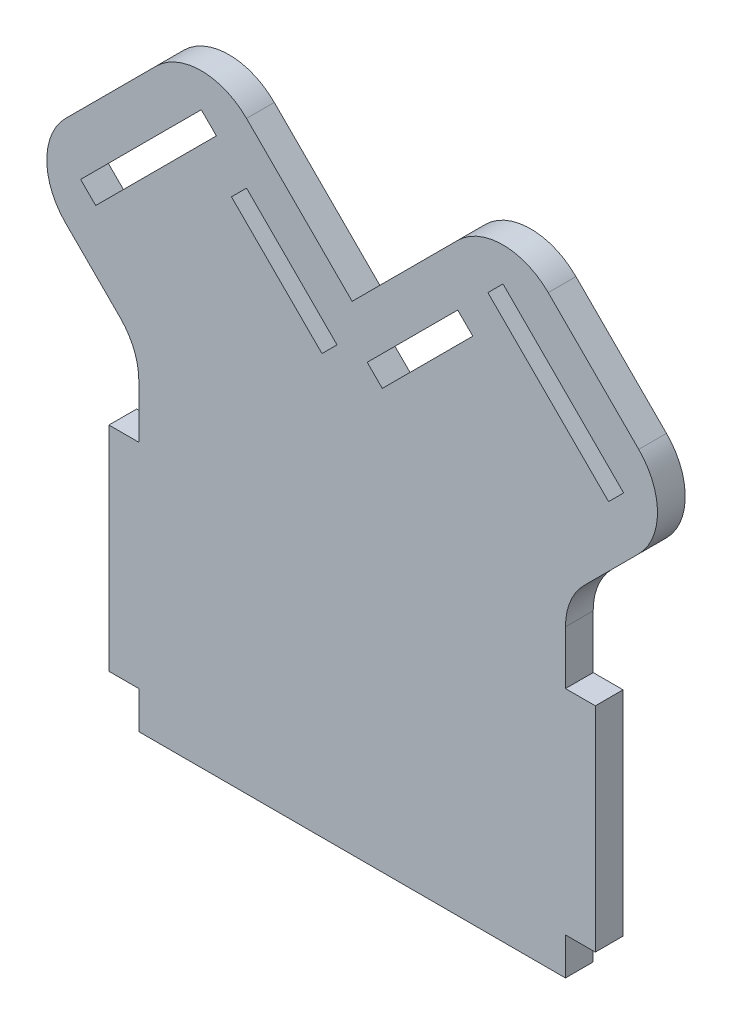
from build123d import *

# Parameters (mm, degrees)
BOSS_EXTRUDE1_DEPTH = 1.3
FILLET1_R           = 3
CUT_EXTRUDE1_DEPTH  = 26.902339963
SKETCH2_3_W         = 1.4
SKETCH2_3_H         = 10
BOSS_EXTRUDE2_DEPTH = 1.3
SKETCH3_W           = 20
SKETCH3_H           = 2
CUT_EXTRUDE2_DEPTH  = 26.902339963
CUT_EXTRUDE3_DEPTH  = 26.902339963


with BuildPart() as part:
    # Sketch1 → Boss-Extrude1 (new body)
    with BuildSketch(Plane.XY):
        Polygon((-15.556349186, 14.306349186), (-10, 8.75), (-10, -8.75), (10, -8.75), (10, 8.75), (15.556349186, 14.306349186), (7.071067812, 22.79163056), (0, 15.720562748), (-7.071067812, 22.79163056), align=None)
    extrude(amount=BOSS_EXTRUDE1_DEPTH)

    # Fillet1
    fillet1_edges = [part.edges().sort_by_distance(p)[0] for p in [
        (-10, 8.75, 0.65),
        (10, 8.75, 0.65),
        (-15.556349186, 14.306349186, 0.65),
        (-7.071067812, 22.79163056, 0.65),
        (7.071067812, 22.79163056, 0.65),
        (15.556349186, 14.306349186, 0.65),
    ]]
    fillet(fillet1_edges, radius=FILLET1_R)

    # Sketch2 → Cut-Extrude1 (cut, through all)
    with BuildSketch(Plane.XY.offset(1.3)):
        Polygon((7.071067812, 19.963203436), (12.727922061, 14.306349186), (12.02081528, 13.599242405), (6.363961031, 19.256096654), align=None)
        Polygon((-12.727922061, 14.306349186), (-12.02081528, 13.599242405), (-6.363961031, 19.256096654), (-7.071067812, 19.963203436), align=None)
    extrude(amount=-CUT_EXTRUDE1_DEPTH, mode=Mode.SUBTRACT)

    # Sketch2<3> → Boss-Extrude2 (add)
    with BuildSketch(Plane.XY.offset(1.3)):
        with Locations((-10.7, 0)):
            Rectangle(SKETCH2_3_W, SKETCH2_3_H)
        with Locations((10.7, 0)):
            Rectangle(SKETCH2_3_W, SKETCH2_3_H)
    extrude(amount=-BOSS_EXTRUDE2_DEPTH)

    # Sketch3 → Cut-Extrude2 (cut, through all)
    with BuildSketch(Plane.XY.offset(1.3)):
        with Locations((0, -7.75)):
            Rectangle(SKETCH3_W, SKETCH3_H)
    extrude(amount=-CUT_EXTRUDE2_DEPTH, mode=Mode.SUBTRACT)

    # Sketch4 → Cut-Extrude3 (cut, through all)
    with BuildSketch(Plane.XY.offset(1.3)):
        Polygon((-4.949747468, 17.841883092), (-0.707106781, 13.599242405), (-1.414213562, 12.892135624), (-5.656854249, 17.134776311), align=None)
        Polygon((1.414213562, 12.892135624), (5.656854249, 17.134776311), (4.949747468, 17.841883092), (0.707106781, 13.599242405), align=None)
    extrude(amount=-CUT_EXTRUDE3_DEPTH, mode=Mode.SUBTRACT)


solid = part.part
